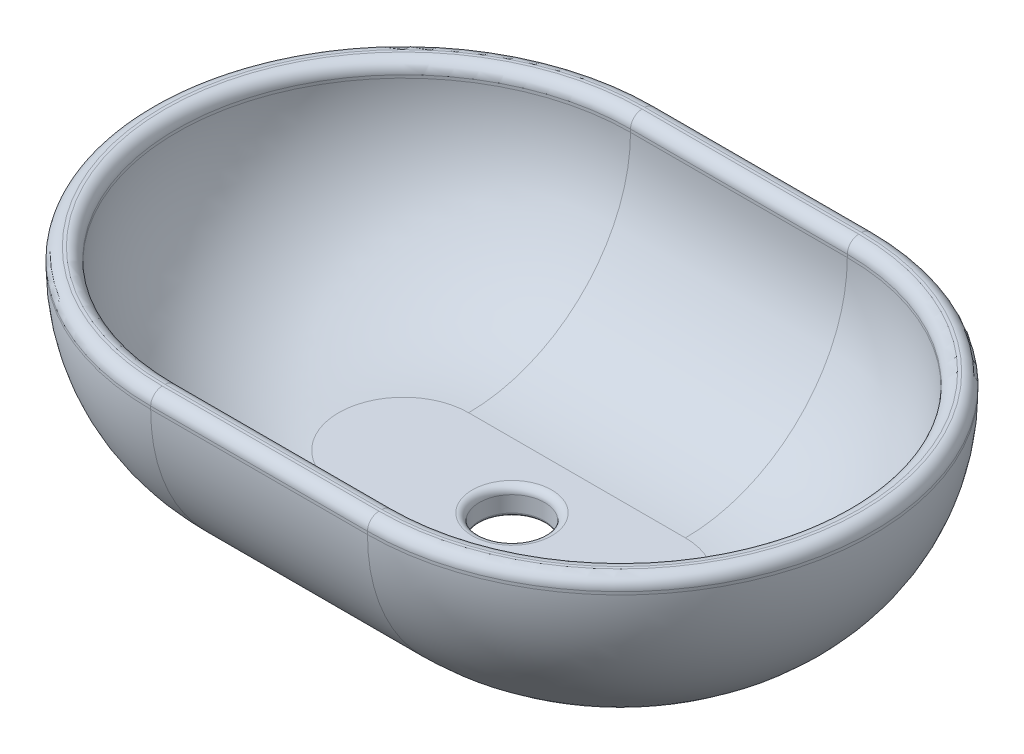
from build123d import *

# Parameters (mm, degrees)
BOSS_EXTRUDE1_DEPTH = 140
FILLET1_R           = 130
SHELL1_T            = -18
SKETCH2_R           = 22.5
CUT_EXTRUDE1_DEPTH  = 140
FILLET2_R           = 5
FILLET3_R           = 2
FILLET4_R           = 8


with BuildPart() as part:
    # Sketch1 → Boss-Extrude1 (new body)
    with BuildSketch(Plane(origin=(0, 0, 0), x_dir=(1, 0, 0), z_dir=(0, 1, 0))):
        with BuildLine():
            Line((-75, 175), (75, 175))
            ThreePointArc((75, 175), (250, 0), (75, -175))
            Line((75, -175), (-75, -175))
            ThreePointArc((-75, -175), (-250, 0), (-75, 175))
        make_face()
    extrude(amount=BOSS_EXTRUDE1_DEPTH)

    # Fillet1
    fillet1_edges = [part.edges().sort_by_distance(p)[0] for p in [
        (0, 0, -175),
        (250, 0, 0),
        (0, 0, 175),
        (-250, 0, 0),
    ]]
    fillet(fillet1_edges, radius=FILLET1_R)

    # Shell1
    shell1_openings = [part.faces().sort_by_distance(p)[0] for p in [
        (0, 140, 0),
    ]]
    offset(amount=SHELL1_T, openings=shell1_openings, kind=Kind.INTERSECTION)

    # Sketch2 → Cut-Extrude1 (cut)
    with BuildSketch(Plane(origin=(0, 18, 0), x_dir=(1, 0, 0), z_dir=(0, 1, 0))):
        with Locations(Location((0, 0, 0), (0, 0, 270))):
            Circle(SKETCH2_R)
    extrude(amount=-CUT_EXTRUDE1_DEPTH, mode=Mode.SUBTRACT)

    # Fillet2
    fillet2_edges = [part.edges().sort_by_distance(p)[0] for p in [
        (0, 18, -22.5),
    ]]
    fillet(fillet2_edges, radius=FILLET2_R)

    # Fillet3
    fillet3_edges = [part.edges().sort_by_distance(p)[0] for p in [
        (0, 0, -22.5),
    ]]
    fillet(fillet3_edges, radius=FILLET3_R)

    # Fillet4
    fillet4_edges = [part.edges().sort_by_distance(p)[0] for p in [
        (250, 140, 0),
        (0, 140, -175),
        (-232, 140, 0),
        (0, 140, 157),
        (232, 140, 0),
        (0, 140, -157),
        (-250, 140, 0),
        (0, 140, 175),
    ]]
    fillet(fillet4_edges, radius=FILLET4_R)


solid = part.part
